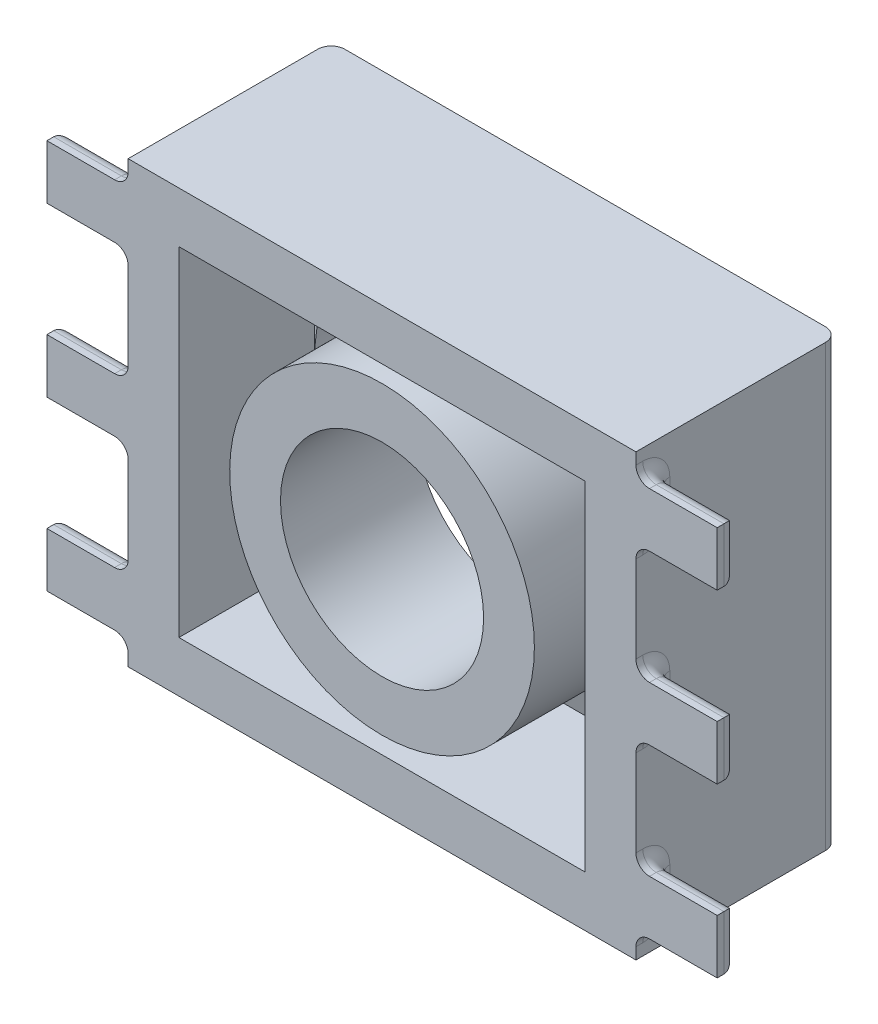
from build123d import *

# Parameters (mm, degrees)
SKETCH_1_W          = 7.5
SKETCH_1_H          = 6.5
EXTRUDE_1_DEPTH     = 3
SKETCH_2_W          = 6
SKETCH_2_H          = 5
CUT_EXTRUDE_1_DEPTH = 2
SKETCH_3_R          = 2.25
EXTRUDE_2_DEPTH     = 1
SKETCH_4_R          = 1.5
CUT_EXTRUDE_2_DEPTH = 1
CUT_EXTRUDE_5_DEPTH = 1
SKETCH_9_W          = 0.3
SKETCH_9_H          = 0.8
EXTRUDE_5_DEPTH     = 1.2
SKETCH_11_W         = 0.3
SKETCH_11_H         = 0.8
EXTRUDE_6_DEPTH     = 1.2
FILLET_4_R          = 0.2
FILLET_5_R          = 0.2


with BuildPart() as part:
    # 草图1 → 凸台-拉伸1 (new body)
    with BuildSketch(Plane.XY):
        Rectangle(SKETCH_1_W, SKETCH_1_H)
    extrude(amount=EXTRUDE_1_DEPTH)

    # 草图2 → 切除-拉伸1 (cut)
    with BuildSketch(Plane.XY.offset(3)):
        Rectangle(SKETCH_2_W, SKETCH_2_H)
    extrude(amount=-CUT_EXTRUDE_1_DEPTH, mode=Mode.SUBTRACT)

    # 草图3 → 凸台-拉伸2 (add, symmetric)
    with BuildSketch(Plane.XY.offset(2)):
        with Locations(Location((0, 0, 0), (0, 0, 180))):
            Circle(SKETCH_3_R)
    extrude(amount=EXTRUDE_2_DEPTH, both=True)

    # 草图4 → 切除-拉伸2 (cut, symmetric)
    with BuildSketch(Plane.XY.offset(2)):
        Circle(SKETCH_4_R)
    extrude(amount=CUT_EXTRUDE_2_DEPTH, both=True, mode=Mode.SUBTRACT)

    # 草图8 → 切除-拉伸5 (cut)
    with BuildSketch(Plane(origin=(0, 0, 0), x_dir=(-1, 0, 0), z_dir=(0, 0, -1))):
        with BuildLine():
            Line((-0.56924828, -2.945497648), (-0.56924828, 2.945497648))
            ThreePointArc((-0.56924828, 2.945497648), (-3, 0), (-0.56924828, -2.945497648))
        make_face()
        with BuildLine():
            Line((0.56924828, -2.945497648), (0.56924828, 2.945497648))
            ThreePointArc((0.56924828, 2.945497648), (3, 0), (0.56924828, -2.945497648))
        make_face()
    extrude(amount=-CUT_EXTRUDE_5_DEPTH, mode=Mode.SUBTRACT)

    # 草图9 → 凸台-拉伸5 (add)
    with BuildSketch(Plane(origin=(3.75, 0, 0), x_dir=(0, 0, -1), z_dir=(1, 0, 0))):
        with Locations((-2.85, 2.48)):
            Rectangle(SKETCH_9_W, SKETCH_9_H)
        with Locations((-2.85, -2.48)):
            Rectangle(SKETCH_9_W, SKETCH_9_H)
        with Locations((-2.85, 0)):
            Rectangle(SKETCH_9_W, SKETCH_9_H)
    extrude(amount=EXTRUDE_5_DEPTH)

    # 草图11 → 凸台-拉伸6 (add)
    with BuildSketch(Plane.ZY.offset(3.75)):
        with Locations((2.85, 2.48)):
            Rectangle(SKETCH_11_W, SKETCH_11_H)
        with Locations((2.85, -2.48)):
            Rectangle(SKETCH_11_W, SKETCH_11_H)
        with Locations((2.85, 0)):
            Rectangle(SKETCH_11_W, SKETCH_11_H)
    extrude(amount=EXTRUDE_6_DEPTH)

    # 圆角4
    fillet_4_edges = [part.edges().sort_by_distance(p)[0] for p in [
        (3.75, -0.4, 2.85),
        (3.75, 0, 2.7),
        (4.35, -0.4, 2.7),
        (3.75, 0.4, 2.85),
        (4.35, 0.4, 2.7),
        (4.95, 0, 2.7),
        (-3.75, 2.88, 2.85),
        (-3.75, 2.48, 2.7),
        (-4.35, 2.88, 2.7),
        (-3.75, 2.08, 2.85),
        (-4.35, 2.08, 2.7),
        (-4.95, 2.48, 2.7),
        (-3.75, -2.08, 2.85),
        (-3.75, -2.48, 2.7),
        (-4.35, -2.08, 2.7),
        (-3.75, -2.88, 2.85),
        (-4.35, -2.88, 2.7),
        (-4.95, -2.48, 2.7),
        (-3.75, 0.4, 2.85),
        (-3.75, 0, 2.7),
        (-4.35, 0.4, 2.7),
        (-3.75, -0.4, 2.85),
        (-4.35, -0.4, 2.7),
        (-4.95, 0, 2.7),
        (3.75, 2.08, 2.85),
        (3.75, 2.48, 2.7),
        (4.35, 2.08, 2.7),
        (3.75, 2.88, 2.85),
        (4.35, 2.88, 2.7),
        (4.95, 2.48, 2.7),
        (3.75, -2.88, 2.85),
        (3.75, -2.48, 2.7),
        (4.35, -2.88, 2.7),
        (3.75, -2.08, 2.85),
        (4.35, -2.08, 2.7),
        (4.95, -2.48, 2.7),
    ]]
    fillet(fillet_4_edges, radius=FILLET_4_R)

    # 圆角5
    fillet_5_edges = [part.edges().sort_by_distance(p)[0] for p in [
        (-3.75, 0, 0),
        (3.75, 0, 0),
    ]]
    fillet(fillet_5_edges, radius=FILLET_5_R)


solid = part.part
